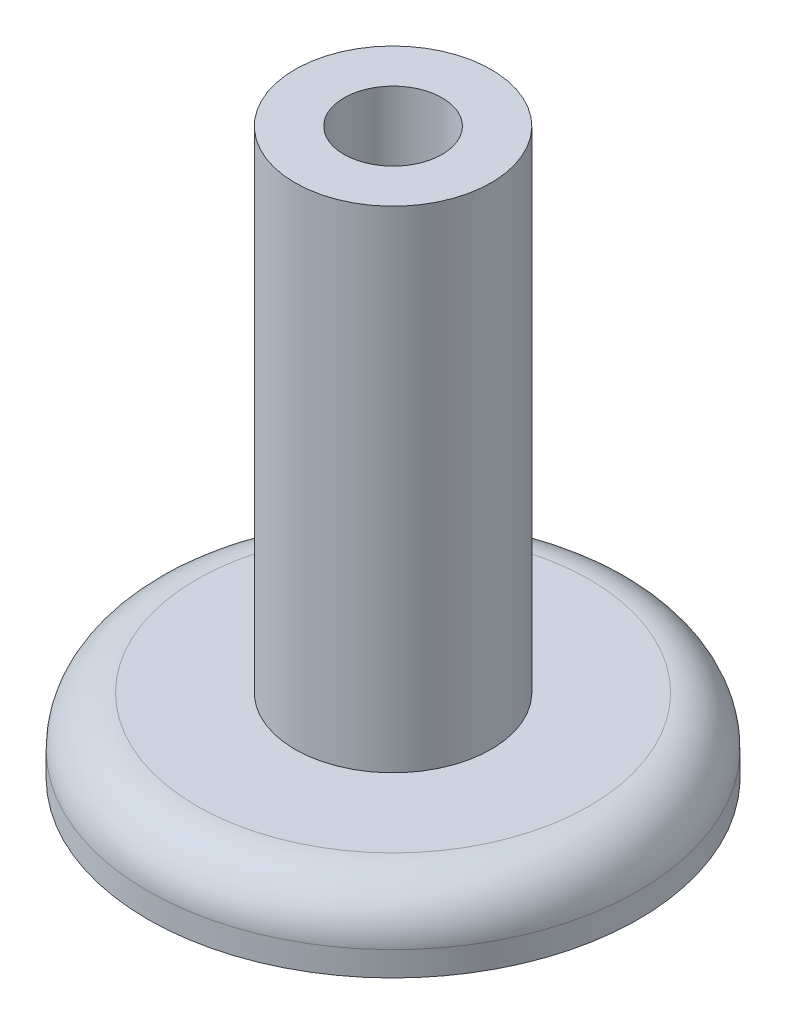
from build123d import *

# Parameters (mm, degrees)
SKETCH_1_R      = 5
SKETCH_1_R_2    = 1
EXTRUDE_1_DEPTH = 1.5
FILLET_1_R      = 1
SKETCH_2_R      = 2
SKETCH_2_R_2    = 1
EXTRUDE_2_DEPTH = 10


with BuildPart() as part:
    # Эскиз1 → Бобышка-Вытянуть1 (new body)
    with BuildSketch(Plane(origin=(0, 0, 0), x_dir=(1, 0, 0), z_dir=(0, 1, 0))):
        with Locations(Location((0, 0, 0), (0, 0, 270))):
            Circle(SKETCH_1_R)
        with Locations(Location((0, 0, 0), (0, 0, 270))):
            Circle(SKETCH_1_R_2, mode=Mode.SUBTRACT)
    extrude(amount=EXTRUDE_1_DEPTH)

    # Скругление1
    fillet_1_edges = [part.edges().sort_by_distance(p)[0] for p in [
        (0, 1.5, -5),
    ]]
    fillet(fillet_1_edges, radius=FILLET_1_R)

    # Эскиз2 → Бобышка-Вытянуть2 (add)
    with BuildSketch(Plane(origin=(0, 1.5, 0), x_dir=(1, 0, 0), z_dir=(0, 1, 0))):
        with Locations(Location((0, 0, 0), (0, 0, 270))):
            Circle(SKETCH_2_R)
        with Locations(Location((0, 0, 0), (0, 0, 270))):
            Circle(SKETCH_2_R_2, mode=Mode.SUBTRACT)
    extrude(amount=EXTRUDE_2_DEPTH)


solid = part.part
